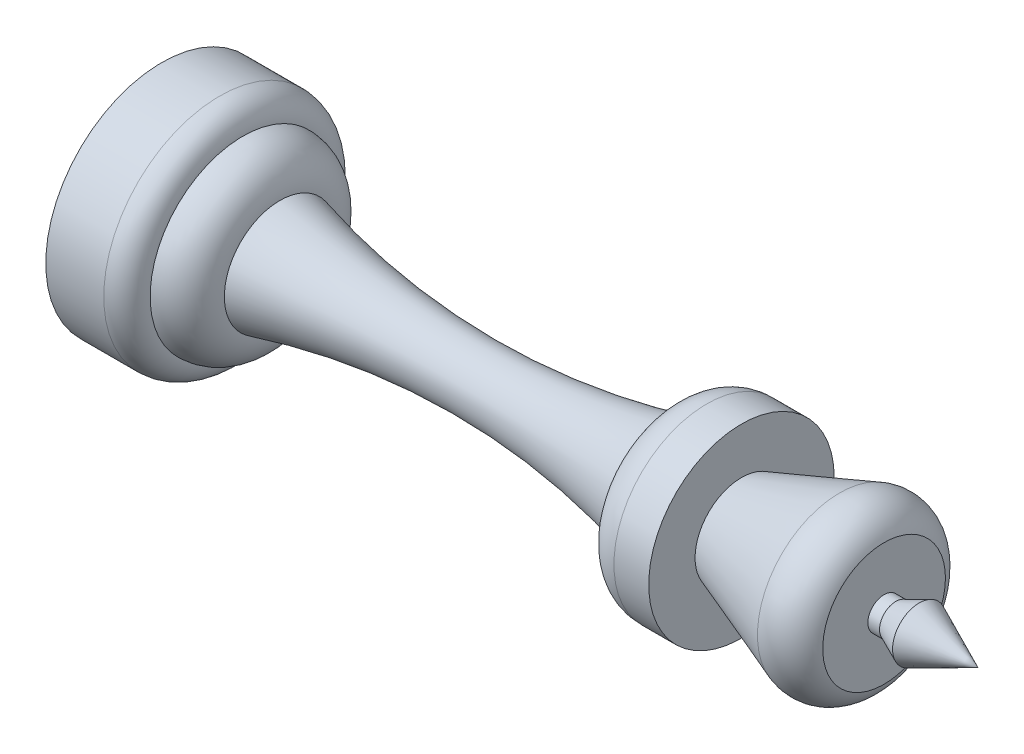
from build123d import *


with BuildPart() as part:
    # Sketch 153 → Повернуть1 (revolve)
    with BuildSketch(Plane(origin=(0, 0, 0), x_dir=(1, 0, 0), z_dir=(0, 1, 0))):
        Polygon((0, 10), (0, 0), (1, 0), (1, 5.25), (3.5, 5.25), (3.5, 0), (5, 0), (5, 10), align=None)
        with BuildLine():
            ThreePointArc((7, 8), (6.414213562, 9.414213562), (5, 10))
            Line((5, 10), (5, 0))
            Line((5, 0), (7, 0))
            Line((7, 0), (7, 8))
        make_face()
        with BuildLine():
            ThreePointArc((10.2, 4.8), (9.2627417, 7.0627417), (7, 8))
            Line((7, 8), (7, 0))
            Line((7, 0), (10.2, 0))
            Line((10.2, 0), (10.2, 4.8))
        make_face()
    revolve(axis=Axis((5, 0, 0), (-1, 0, 0)))

    # Sketch 882 → Повернуть2 (revolve)
    with BuildSketch(Plane(origin=(0, 0, 0), x_dir=(1, 0, 0), z_dir=(0, 1, 0))):
        with BuildLine():
            Line((10.2, 4.8), (10.2, 0))
            Line((10.2, 0), (70.4, 0))
            Line((70.4, 0), (65.331156927, 2.3))
            Line((65.331156927, 2.3), (63.30687842, 1.4))
            Line((63.30687842, 1.4), (62.3, 1.4))
            Line((62.3, 1.4), (62.3, 5.291657255))
            ThreePointArc((62.3, 5.291657255), (60.748015293, 6.979485771), (58.457233587, 7.07818129))
            Line((58.457233587, 7.07818129), (50, 4))
            Line((50, 4), (50, 8))
            Line((50, 8), (47, 8))
            ThreePointArc((47, 8), (44.7372583, 7.0627417), (43.8, 4.8))
            ThreePointArc((43.8, 4.8), (27, 2.591400685), (10.2, 4.8))
        make_face()
    revolve(axis=Axis((50, 0, 0), (-1, 0, 0)))


solid = part.part
